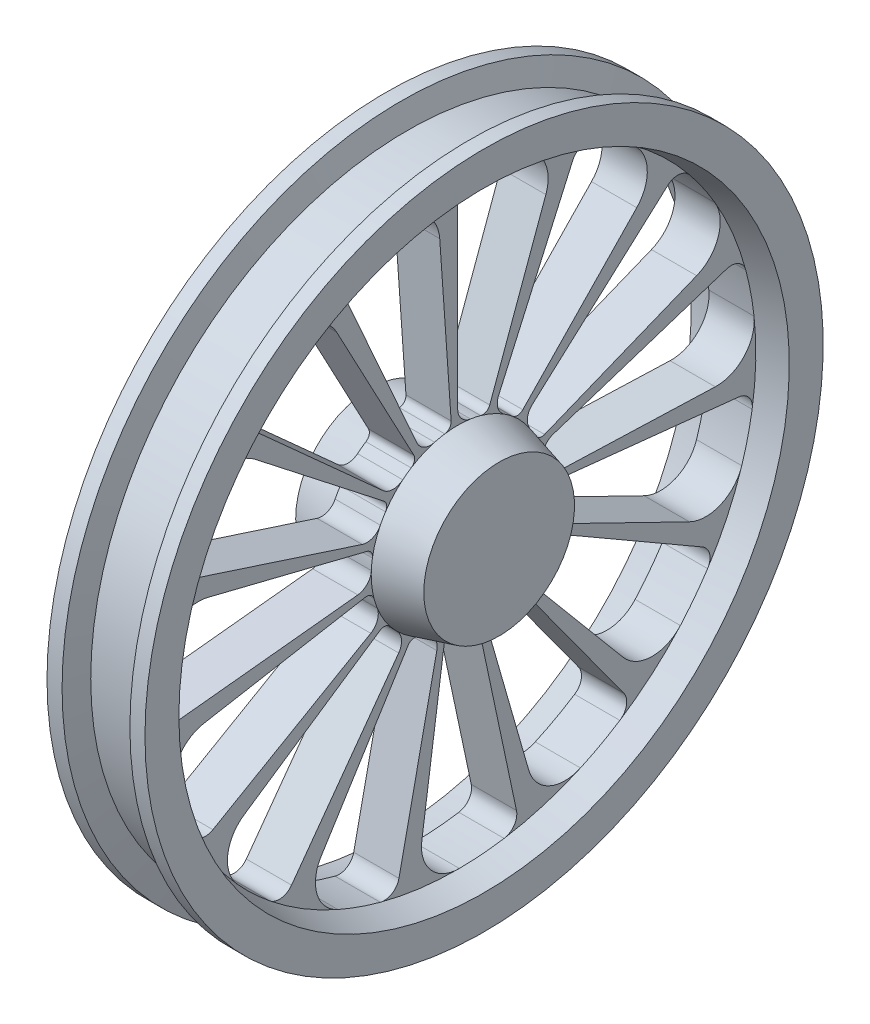
from build123d import *

# Parameters (mm, degrees)
ENL_V_MAT_EXTRU_1_REACH = 648.703


with BuildPart() as part:
    # Esquisse1 → Révolution1 (revolve)
    with BuildSketch(Plane.XY, mode=Mode.PRIVATE) as r_volution1_sk:
        Polygon((-85, 0), (-85, 100), (-30, 114.737205584), (-30, 395.621778265), (-65, 405), (-65, 450), (-45, 450), (-36.961524227, 420), (36.961524227, 420), (45, 450), (65, 450), (65, 405), (30, 395.621778265), (30, 114.737205584), (85, 100), (85, 0), align=None)
    revolve(r_volution1_sk.sketch.rotate(Axis((-448.15557493, 0, 0), (1, 0, 0)), 90), axis=Axis((-448.15557493, 0, 0), (1, 0, 0)))

    # Esquisse2 → Enlèv. mat.-Extru.1 (cut, up to next)
    with BuildSketch(Plane(origin=(30, 0, 0), x_dir=(0, 0, -1), z_dir=(1, 0, 0)), mode=Mode.PRIVATE) as enl_v_mat_extru_1_sk1:
        with BuildLine():
            Line((0, 375.08894986), (0, 133.24456675))
            ThreePointArc((0, 133.24456675), (4.844558076, 120.194180546), (17.031258009, 113.46612973))
            ThreePointArc((17.031258009, 113.46612973), (23.794589812, 112.242789705), (30.472538424, 110.616683855))
            ThreePointArc((30.472538424, 110.616683855), (37.714753572, 111.371314729), (42.525319659, 116.837355519))
            Line((42.525319659, 116.837355519), (116.966095442, 321.36170607))
            ThreePointArc((116.966095442, 321.36170607), (113.645015457, 362.824451872), (80.105459591, 387.427034138))
            ThreePointArc((80.105459591, 387.427034138), (50.728968231, 392.35591396), (21.064900981, 395.060579385))
            ThreePointArc((21.064900981, 395.060579385), (6.239513446, 389.602702297), (0, 375.08894986))
        make_face()
    enl_v_mat_extru_1_tool1 = extrude(enl_v_mat_extru_1_sk1.sketch, amount=-ENL_V_MAT_EXTRU_1_REACH, mode=Mode.PRIVATE) & part.part
    # Esquisse2 → Enlèv. mat.-Extru.1 (cut, up to next)
    with BuildSketch(Plane(origin=(30, 0, 0), x_dir=(0, 0, -1), z_dir=(1, 0, 0)), mode=Mode.PRIVATE) as enl_v_mat_extru_1_sk2:
        with BuildLine():
            Line((152.562420321, 342.660806356), (54.195447788, 121.72496871))
            ThreePointArc((54.195447788, 121.72496871), (53.313101537, 107.832388384), (61.709661101, 96.729230701))
            ThreePointArc((61.709661101, 96.729230701), (67.390694934, 92.860759105), (72.82990772, 88.659071091))
            ThreePointArc((72.82990772, 88.659071091), (79.7529365, 86.40278642), (86.370846379, 89.439629654))
            Line((86.370846379, 89.439629654), (237.563426729, 246.004129826))
            ThreePointArc((237.563426729, 246.004129826), (251.393887235, 285.233037841), (230.760750044, 321.350381479))
            ThreePointArc((230.760750044, 321.350381479), (205.928745834, 337.801632733), (179.929358477, 352.337930679))
            ThreePointArc((179.929358477, 352.337930679), (164.165774432, 353.381940215), (152.562420321, 342.660806356))
        make_face()
    enl_v_mat_extru_1_tool2 = extrude(enl_v_mat_extru_1_sk2.sketch, amount=-ENL_V_MAT_EXTRU_1_REACH, mode=Mode.PRIVATE) & part.part
    # Esquisse2 → Enlèv. mat.-Extru.1 (cut, up to next)
    with BuildSketch(Plane(origin=(30, 0, 0), x_dir=(0, 0, -1), z_dir=(1, 0, 0)), mode=Mode.PRIVATE) as enl_v_mat_extru_1_sk3:
        with BuildLine():
            Line((278.745412182, 250.983496458), (99.020010304, 89.158017744))
            ThreePointArc((99.020010304, 89.158017744), (92.563325408, 76.825396644), (95.717903174, 63.266968927))
            ThreePointArc((95.717903174, 63.266968927), (99.334336676, 57.422259641), (102.594324332, 51.371499492))
            ThreePointArc((102.594324332, 51.371499492), (108.001112174, 46.494431395), (115.282069106, 46.576979287))
            Line((115.282069106, 46.576979287), (317.083883339, 128.110204659))
            ThreePointArc((317.083883339, 128.110204659), (345.674472068, 158.322240305), (341.515410419, 199.709328485))
            ThreePointArc((341.515410419, 199.709328485), (325.521572478, 224.838380374), (307.682395286, 248.69285287))
            ThreePointArc((307.682395286, 248.69285287), (293.70628162, 256.058230296), (278.745412182, 250.983496458))
        make_face()
    enl_v_mat_extru_1_tool3 = extrude(enl_v_mat_extru_1_sk3.sketch, amount=-ENL_V_MAT_EXTRU_1_REACH, mode=Mode.PRIVATE) & part.part
    # Esquisse2 → Enlèv. mat.-Extru.1 (cut, up to next)
    with BuildSketch(Plane(origin=(30, 0, 0), x_dir=(0, 0, -1), z_dir=(1, 0, 0)), mode=Mode.PRIVATE) as enl_v_mat_extru_1_sk4:
        with BuildLine():
            Line((356.730789954, 115.908859909), (126.723113469, 41.174835534))
            ThreePointArc((126.723113469, 41.174835534), (115.808509405, 32.534595887), (113.175650218, 18.865273462))
            ThreePointArc((113.175650218, 18.865273462), (114.102169183, 12.054929821), (114.619250226, 5.201328936))
            ThreePointArc((114.619250226, 5.201328936), (117.574914394, -1.453233208), (124.259974779, -4.339253936))
            Line((124.259974779, -4.339253936), (341.777655903, -11.935138739))
            ThreePointArc((341.777655903, -11.935138739), (380.184800327, 4.036089109), (393.218953762, 43.536718294))
            ThreePointArc((393.218953762, 43.536718294), (388.82876197, 72.998529456), (382.234350743, 102.046521495))
            ThreePointArc((382.234350743, 102.046521495), (372.462304477, 114.459726143), (356.730789954, 115.908859909))
        make_face()
    enl_v_mat_extru_1_tool4 = extrude(enl_v_mat_extru_1_sk4.sketch, amount=-ENL_V_MAT_EXTRU_1_REACH, mode=Mode.PRIVATE) & part.part
    # Esquisse2 → Enlèv. mat.-Extru.1 (cut, up to next)
    with BuildSketch(Plane(origin=(30, 0, 0), x_dir=(0, 0, -1), z_dir=(1, 0, 0)), mode=Mode.PRIVATE) as enl_v_mat_extru_1_sk5:
        with BuildLine():
            Line((373.034173346, -39.207471518), (132.514639072, -13.927849801))
            ThreePointArc((132.514639072, -13.927849801), (119.029350038, -17.381732066), (111.064299172, -28.798399169))
            ThreePointArc((111.064299172, -28.798399169), (109.140700052, -35.39680688), (106.825466474, -41.868198646))
            ThreePointArc((106.825466474, -41.868198646), (106.818945781, -49.149620586), (111.752201947, -54.505190733))
            Line((111.752201947, -54.505190733), (307.374966808, -149.916788222))
            ThreePointArc((307.374966808, -149.916788222), (348.957722738, -150.947938561), (376.931367718, -120.163786009))
            ThreePointArc((376.931367718, -120.163786009), (384.903926118, -91.463430376), (390.694514467, -62.24458051))
            ThreePointArc((390.694514467, -62.24458051), (386.816211177, -46.929904495), (373.034173346, -39.207471518))
        make_face()
    enl_v_mat_extru_1_tool5 = extrude(enl_v_mat_extru_1_sk5.sketch, amount=-ENL_V_MAT_EXTRU_1_REACH, mode=Mode.PRIVATE) & part.part
    # Esquisse2 → Enlèv. mat.-Extru.1 (cut, up to next)
    with BuildSketch(Plane(origin=(30, 0, 0), x_dir=(0, 0, -1), z_dir=(1, 0, 0)), mode=Mode.PRIVATE) as enl_v_mat_extru_1_sk6:
        with BuildLine():
            Line((324.836559257, -187.54447493), (115.393179722, -66.622283375))
            ThreePointArc((115.393179722, -66.622283375), (101.668934702, -64.292600637), (89.74892181, -71.482566959))
            ThreePointArc((89.74892181, -71.482566959), (85.30781237, -76.728114103), (80.560589089, -81.698334321))
            ThreePointArc((80.560589089, -81.698334321), (77.593011023, -88.347592055), (79.921458161, -95.246684889))
            Line((79.921458161, -95.246684889), (219.824353539, -261.976463069))
            ThreePointArc((219.824353539, -261.976463069), (257.392684707, -279.831696335), (295.468923881, -263.086880057))
            ThreePointArc((295.468923881, -263.086880057), (314.425704699, -240.110532176), (331.600047291, -215.77302907))
            ThreePointArc((331.600047291, -215.77302907), (334.286080849, -200.2049283), (324.836559257, -187.54447493))
        make_face()
    enl_v_mat_extru_1_tool6 = extrude(enl_v_mat_extru_1_sk6.sketch, amount=-ENL_V_MAT_EXTRU_1_REACH, mode=Mode.PRIVATE) & part.part
    # Esquisse2 → Enlèv. mat.-Extru.1 (cut, up to next)
    with BuildSketch(Plane(origin=(30, 0, 0), x_dir=(0, 0, -1), z_dir=(1, 0, 0)), mode=Mode.PRIVATE) as enl_v_mat_extru_1_sk7:
        with BuildLine():
            Line((220.471753025, -303.453334839), (78.319191284, -107.797118909))
            ThreePointArc((78.319191284, -107.797118909), (66.729036923, -100.086694478), (52.915140525, -101.806749523))
            ThreePointArc((52.915140525, -101.806749523), (46.724428933, -104.792433344), (40.366053981, -107.402085786))
            ThreePointArc((40.366053981, -107.402085786), (34.950539748, -112.269462245), (34.271568195, -119.519161938))
            Line((34.271568195, -119.519161938), (94.264112501, -328.738027471))
            ThreePointArc((94.264112501, -328.738027471), (121.322113151, -360.330011621), (162.917218854, -360.519862474))
            ThreePointArc((162.917218854, -360.519862474), (189.580422469, -347.240341628), (215.168919447, -331.992360668))
            ThreePointArc((215.168919447, -331.992360668), (223.954850249, -318.862701198), (220.471753025, -303.453334839))
        make_face()
    enl_v_mat_extru_1_tool7 = extrude(enl_v_mat_extru_1_sk7.sketch, amount=-ENL_V_MAT_EXTRU_1_REACH, mode=Mode.PRIVATE) & part.part
    # Esquisse2 → Enlèv. mat.-Extru.1 (cut, up to next)
    with BuildSketch(Plane(origin=(30, 0, 0), x_dir=(0, 0, -1), z_dir=(1, 0, 0)), mode=Mode.PRIVATE) as enl_v_mat_extru_1_sk8:
        with BuildLine():
            Line((77.985377772, -366.892356367), (27.703103165, -130.332853278))
            ThreePointArc((27.703103165, -130.332853278), (20.251082445, -118.574889584), (6.931850724, -114.527620209))
            ThreePointArc((6.931850724, -114.527620209), (0.061967254, -114.73718885), (-6.808138575, -114.535040901))
            ThreePointArc((-6.808138575, -114.535040901), (-13.735197365, -116.778922477), (-17.304187259, -123.12569009))
            Line((-17.304187259, -123.12569009), (-47.595249951, -338.657800431))
            ThreePointArc((-47.595249951, -338.657800431), (-35.726153945, -378.523994403), (2.195646631, -395.615685449))
            ThreePointArc((2.195646631, -395.615685449), (31.954962911, -394.329141432), (61.533130682, -390.80719705))
            ThreePointArc((61.533130682, -390.80719705), (74.899791474, -382.386216282), (77.985377772, -366.892356367))
        make_face()
    enl_v_mat_extru_1_tool8 = extrude(enl_v_mat_extru_1_sk8.sketch, amount=-ENL_V_MAT_EXTRU_1_REACH, mode=Mode.PRIVATE) & part.part
    # Esquisse2 → Enlèv. mat.-Extru.1 (cut, up to next)
    with BuildSketch(Plane(origin=(30, 0, 0), x_dir=(0, 0, -1), z_dir=(1, 0, 0)), mode=Mode.PRIVATE) as enl_v_mat_extru_1_sk9:
        with BuildLine():
            Line((-77.985377772, -366.892356367), (-27.703103165, -130.332853278))
            ThreePointArc((-27.703103165, -130.332853278), (-29.728468162, -116.560409062), (-40.250019041, -107.44562491))
            ThreePointArc((-40.250019041, -107.44562491), (-46.611209125, -104.84284205), (-52.805142121, -101.863846927))
            ThreePointArc((-52.805142121, -101.863846927), (-60.045994073, -101.096246109), (-65.887891532, -105.442667864))
            Line((-65.887891532, -105.442667864), (-181.224961297, -290.020563088))
            ThreePointArc((-181.224961297, -290.020563088), (-186.597044463, -331.26773977), (-158.905572841, -362.305962354))
            ThreePointArc((-158.905572841, -362.305962354), (-131.195800037, -373.234850316), (-102.742295389, -382.04791869))
            ThreePointArc((-102.742295389, -382.04791869), (-87.106121689, -379.791680701), (-77.985377772, -366.892356367))
        make_face()
    enl_v_mat_extru_1_tool9 = extrude(enl_v_mat_extru_1_sk9.sketch, amount=-ENL_V_MAT_EXTRU_1_REACH, mode=Mode.PRIVATE) & part.part
    # Esquisse2 → Enlèv. mat.-Extru.1 (cut, up to next)
    with BuildSketch(Plane(origin=(30, 0, 0), x_dir=(0, 0, -1), z_dir=(1, 0, 0)), mode=Mode.PRIVATE) as enl_v_mat_extru_1_sk10:
        with BuildLine():
            Line((-220.471753025, -303.453334839), (-78.319191284, -107.797118909))
            ThreePointArc((-78.319191284, -107.797118909), (-74.56769655, -94.391574896), (-80.472294854, -81.785304952))
            ThreePointArc((-80.472294854, -81.785304952), (-85.224883997, -76.820215392), (-89.671656875, -71.579468415))
            ThreePointArc((-89.671656875, -71.579468415), (-95.974292905, -67.933110359), (-103.078980787, -69.527650448))
            Line((-103.078980787, -69.527650448), (-283.519230458, -191.236135632))
            ThreePointArc((-283.519230458, -191.236135632), (-305.203610812, -226.732283458), (-292.530575158, -266.350246922))
            ThreePointArc((-292.530575158, -266.350246922), (-271.661617282, -287.604862847), (-249.252645203, -307.229084393))
            ThreePointArc((-249.252645203, -307.229084393), (-234.050595078, -311.527713227), (-220.471753025, -303.453334839))
        make_face()
    enl_v_mat_extru_1_tool10 = extrude(enl_v_mat_extru_1_sk10.sketch, amount=-ENL_V_MAT_EXTRU_1_REACH, mode=Mode.PRIVATE) & part.part
    # Esquisse2 → Enlèv. mat.-Extru.1 (cut, up to next)
    with BuildSketch(Plane(origin=(30, 0, 0), x_dir=(0, 0, -1), z_dir=(1, 0, 0)), mode=Mode.PRIVATE) as enl_v_mat_extru_1_sk11:
        with BuildLine():
            Line((-324.836559257, -187.54447493), (-115.393179722, -66.622283375))
            ThreePointArc((-115.393179722, -66.622283375), (-106.513492778, -55.901579909), (-106.780179819, -41.983562771))
            ThreePointArc((-106.780179819, -41.983562771), (-109.102402183, -35.514675603), (-111.033127513, -28.918349534))
            ThreePointArc((-111.033127513, -28.918349534), (-115.307764594, -23.023722674), (-122.44677782, -21.590670631))
            Line((-122.44677782, -21.590670631), (-336.790448981, -59.385243))
            ThreePointArc((-336.790448981, -59.385243), (-371.037700164, -82.992755537), (-375.574383472, -124.340154081))
            ThreePointArc((-375.574383472, -124.340154081), (-365.15467293, -152.245381784), (-352.664948272, -179.287550315))
            ThreePointArc((-352.664948272, -179.287550315), (-340.525594295, -189.397773997), (-324.836559257, -187.54447493))
        make_face()
    enl_v_mat_extru_1_tool11 = extrude(enl_v_mat_extru_1_sk11.sketch, amount=-ENL_V_MAT_EXTRU_1_REACH, mode=Mode.PRIVATE) & part.part
    # Esquisse2 → Enlèv. mat.-Extru.1 (cut, up to next)
    with BuildSketch(Plane(origin=(30, 0, 0), x_dir=(0, 0, -1), z_dir=(1, 0, 0)), mode=Mode.PRIVATE) as enl_v_mat_extru_1_sk12:
        with BuildLine():
            Line((-373.034173346, -39.207471518), (-132.514639072, -13.927849801))
            ThreePointArc((-132.514639072, -13.927849801), (-120.04213846, -7.745693906), (-114.624801626, 5.077518822))
            ThreePointArc((-114.624801626, 5.077518822), (-114.115123866, 11.931674239), (-113.1959617, 18.743014695))
            ThreePointArc((-113.1959617, 18.743014695), (-114.703476248, 25.866675825), (-120.642414575, 30.079532284))
            Line((-120.642414575, 30.079532284), (-331.82753923, 82.733897645))
            ThreePointArc((-331.82753923, 82.733897645), (-372.716000386, 75.096973781), (-393.677968898, 39.169480995))
            ThreePointArc((-393.677968898, 39.169480995), (-395.509168303, 9.438708895), (-395.098277924, -20.345570012))
            ThreePointArc((-395.098277924, -20.345570012), (-388.120624681, -34.519239017), (-373.034173346, -39.207471518))
        make_face()
    enl_v_mat_extru_1_tool12 = extrude(enl_v_mat_extru_1_sk12.sketch, amount=-ENL_V_MAT_EXTRU_1_REACH, mode=Mode.PRIVATE) & part.part
    # Esquisse2 → Enlèv. mat.-Extru.1 (cut, up to next)
    with BuildSketch(Plane(origin=(30, 0, 0), x_dir=(0, 0, -1), z_dir=(1, 0, 0)), mode=Mode.PRIVATE) as enl_v_mat_extru_1_sk13:
        with BuildLine():
            Line((-356.730789954, 115.908859909), (-126.723113469, 41.174835534))
            ThreePointArc((-126.723113469, 41.174835534), (-112.814407853, 41.74949294), (-102.649753898, 51.260651282))
            ThreePointArc((-102.649753898, 51.260651282), (-99.39630393, 57.314929209), (-95.786185757, 63.163541409))
            ThreePointArc((-95.786185757, 63.163541409), (-94.265914809, 70.284491082), (-97.977881847, 76.548710803))
            Line((-97.977881847, 76.548710803), (-269.488633388, 210.547595773))
            ThreePointArc((-269.488633388, 210.547595773), (-309.948318122, 220.201754098), (-343.71105705, 195.906356964))
            ThreePointArc((-343.71105705, 195.906356964), (-357.476535388, 169.490761059), (-369.215525968, 142.11434418))
            ThreePointArc((-369.215525968, 142.11434418), (-368.606073094, 126.327985986), (-356.730789954, 115.908859909))
        make_face()
    enl_v_mat_extru_1_tool13 = extrude(enl_v_mat_extru_1_sk13.sketch, amount=-ENL_V_MAT_EXTRU_1_REACH, mode=Mode.PRIVATE) & part.part
    # Esquisse2 → Enlèv. mat.-Extru.1 (cut, up to next)
    with BuildSketch(Plane(origin=(30, 0, 0), x_dir=(0, 0, -1), z_dir=(1, 0, 0)), mode=Mode.PRIVATE) as enl_v_mat_extru_1_sk14:
        with BuildLine():
            Line((-278.745412182, 250.983496458), (-99.020010304, 89.158017744))
            ThreePointArc((-99.020010304, 89.158017744), (-86.080041242, 84.025813175), (-72.925631177, 88.580351448))
            ThreePointArc((-72.925631177, 88.580351448), (-67.490960057, 92.787912228), (-61.814108105, 96.662517991))
            ThreePointArc((-61.814108105, 96.662517991), (-57.528920322, 102.549479317), (-58.372083247, 109.7819218))
            Line((-58.372083247, 109.7819218), (-160.552694605, 301.955701827))
            ThreePointArc((-160.552694605, 301.955701827), (-193.587755864, 327.231650661), (-234.313380921, 318.769244061))
            ThreePointArc((-234.313380921, 318.769244061), (-257.632961932, 300.23632086), (-279.492055354, 280.001397195))
            ThreePointArc((-279.492055354, 280.001397195), (-285.356182788, 265.331954558), (-278.745412182, 250.983496458))
        make_face()
    enl_v_mat_extru_1_tool14 = extrude(enl_v_mat_extru_1_sk14.sketch, amount=-ENL_V_MAT_EXTRU_1_REACH, mode=Mode.PRIVATE) & part.part
    # Esquisse2 → Enlèv. mat.-Extru.1 (cut, up to next)
    with BuildSketch(Plane(origin=(30, 0, 0), x_dir=(0, 0, -1), z_dir=(1, 0, 0)), mode=Mode.PRIVATE) as enl_v_mat_extru_1_sk15:
        with BuildLine():
            Line((-152.562420321, 342.660806356), (-54.195447788, 121.72496871))
            ThreePointArc((-54.195447788, 121.72496871), (-44.461653488, 111.773306962), (-30.592004317, 110.583704121))
            ThreePointArc((-30.592004317, 110.583704121), (-23.915816055, 112.217022272), (-17.153809599, 113.44766706))
            ThreePointArc((-17.153809599, 113.44766706), (-10.844652876, 117.082730945), (-8.67322116, 124.032841181))
            Line((-8.67322116, 124.032841181), (-23.85573635, 341.152923854))
            ThreePointArc((-23.85573635, 341.152923854), (-43.754111926, 377.680222019), (-84.40079256, 386.514032931))
            ThreePointArc((-84.40079256, 386.514032931), (-113.242308836, 379.068293223), (-141.441869264, 369.473664903))
            ThreePointArc((-141.441869264, 369.473664903), (-152.765616099, 358.457617722), (-152.562420321, 342.660806356))
        make_face()
    enl_v_mat_extru_1_tool15 = extrude(enl_v_mat_extru_1_sk15.sketch, amount=-ENL_V_MAT_EXTRU_1_REACH, mode=Mode.PRIVATE) & part.part
    add(enl_v_mat_extru_1_tool1.solids().sort_by_distance((30, 272.930042, -46.898352))[0], mode=Mode.SUBTRACT)
    add(enl_v_mat_extru_1_tool2.solids().sort_by_distance((30, 230.258722, -153.854426))[0], mode=Mode.SUBTRACT)
    add(enl_v_mat_extru_1_tool3.solids().sort_by_distance((30, 147.773577, -234.207672))[0], mode=Mode.SUBTRACT)
    add(enl_v_mat_extru_1_tool4.solids().sort_by_distance((30, 39.737038, -274.064283))[0], mode=Mode.SUBTRACT)
    add(enl_v_mat_extru_1_tool5.solids().sort_by_distance((30, -75.170396, -266.53269))[0], mode=Mode.SUBTRACT)
    add(enl_v_mat_extru_1_tool6.solids().sort_by_distance((30, -177.080186, -212.915174))[0], mode=Mode.SUBTRACT)
    add(enl_v_mat_extru_1_tool7.solids().sort_by_distance((30, -248.371202, -122.48269))[0], mode=Mode.SUBTRACT)
    add(enl_v_mat_extru_1_tool8.solids().sort_by_distance((30, -276.716582, -10.871836))[0], mode=Mode.SUBTRACT)
    add(enl_v_mat_extru_1_tool9.solids().sort_by_distance((30, -257.215151, 102.618857))[0], mode=Mode.SUBTRACT)
    add(enl_v_mat_extru_1_tool10.solids().sort_by_distance((30, -193.238883, 198.365818))[0], mode=Mode.SUBTRACT)
    add(enl_v_mat_extru_1_tool11.solids().sort_by_distance((30, -95.849857, 259.813526))[0], mode=Mode.SUBTRACT)
    add(enl_v_mat_extru_1_tool12.solids().sort_by_distance((30, 18.11248, 276.337116))[0], mode=Mode.SUBTRACT)
    add(enl_v_mat_extru_1_tool13.solids().sort_by_distance((30, 128.943005, 245.079508))[0], mode=Mode.SUBTRACT)
    add(enl_v_mat_extru_1_tool14.solids().sort_by_distance((30, 217.478112, 171.445426))[0], mode=Mode.SUBTRACT)
    add(enl_v_mat_extru_1_tool15.solids().sort_by_distance((30, 268.409279, 68.166873))[0], mode=Mode.SUBTRACT)


solid = part.part
